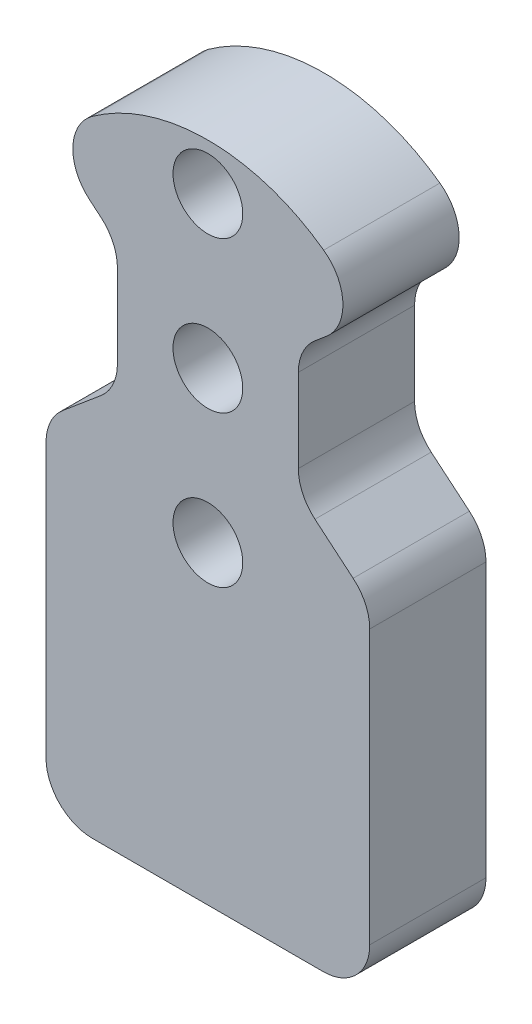
from build123d import *

# Parameters (mm, degrees)
SKETCH_1_R          = 8.5
EXTRUDE_1_DEPTH     = 5
SKETCH_2_R          = 1.5
CUT_EXTRUDE_1_DEPTH = 5
CUT_EXTRUDE_2_DEPTH = 14.019216566
EXTRUDE_2_DEPTH     = 5
SKETCH_6_R          = 1.5
CUT_EXTRUDE_3_DEPTH = 22.759606561
FILLET_2_R          = 2


with BuildPart() as part:
    # 草图1 → 凸台-拉伸1 (new body)
    with BuildSketch(Plane.XY):
        Circle(SKETCH_1_R)
    extrude(amount=EXTRUDE_1_DEPTH)

    # 草图2 → 切除-拉伸1 (cut)
    with BuildSketch(Plane.XY.offset(5)):
        with Locations((0, 6.5)):
            Circle(SKETCH_2_R)
        with Locations((0, -6.5)):
            Circle(SKETCH_2_R)
    extrude(amount=-CUT_EXTRUDE_1_DEPTH, mode=Mode.SUBTRACT)

    # 草图3 → 切除-拉伸2 (cut, through all)
    with BuildSketch(Plane(origin=(0, 0, 0), x_dir=(-1, 0, 0), z_dir=(0, 0, -1))):
        with BuildLine():
            ThreePointArc((3.89097221, 2.724488073), (4.530155516, 1.428352548), (4.75, 0))
            Line((4.75, 0), (8.5, 0))
            ThreePointArc((8.5, 0), (8.106594081, 2.555999296), (6.962792376, 4.875399709))
            Line((6.962792376, 4.875399709), (3.89097221, 2.724488073))
        make_face()
        with BuildLine():
            Line((8.5, 0), (4.75, 0))
            ThreePointArc((4.75, 0), (4.530155516, -1.428352548), (3.89097221, -2.724488073))
            Line((3.89097221, -2.724488073), (6.962792376, -4.875399709))
            ThreePointArc((6.962792376, -4.875399709), (8.106594081, -2.555999296), (8.5, 0))
        make_face()
    cut_extrude_2 = extrude(amount=-CUT_EXTRUDE_2_DEPTH, mode=Mode.SUBTRACT)

    # 镜向1: 切除-拉伸2 across plane
    add(cut_extrude_2.mirror(Plane(origin=(0, 0, 0), x_dir=(0, 0, 1), z_dir=(1, 0, 0))), mode=Mode.SUBTRACT)


with BuildPart() as body_2:
    # 草图4 → 凸台-拉伸2 (new body)
    with BuildSketch(Plane(origin=(0, 0, 0), x_dir=(-1, 0, 0), z_dir=(0, 0, -1))):
        with BuildLine():
            ThreePointArc((6.962792376, -4.875399709), (0, -8.5), (-6.962792376, -4.875399709))
            Line((-6.962792376, -4.875399709), (-6.962792376, -20))
            Line((-6.962792376, -20), (6.962792376, -20))
            Line((6.962792376, -20), (6.962792376, -4.875399709))
        make_face()
    extrude(amount=-EXTRUDE_2_DEPTH)


with BuildPart() as part_1:
    add(part.part)

    # Combine 1: union body 2
    add(body_2.part)

    # 草图6 → 切除-拉伸3 (cut, through all)
    with BuildSketch(Plane(origin=(0, 0, 0), x_dir=(-1, 0, 0), z_dir=(0, 0, -1))):
        with BuildLine():
            Line((-6.962792376, 4.875399709), (-3.89097221, 2.724488073))
            Line((-3.89097221, 2.724488073), (-6.769757712, 5.140075925))
            ThreePointArc((-6.769757712, 5.140075925), (-6.867550244, 5.008667851), (-6.962792376, 4.875399709))
        make_face()
        with BuildLine():
            Line((-3.89097221, -2.724488073), (-3.89097221, 2.724488073))
            ThreePointArc((-3.89097221, 2.724488073), (-4.75, 0), (-3.89097221, -2.724488073))
        make_face()
        Polygon((-6.962792376, -5.302051241), (-3.89097221, -2.724488073), (-6.962792376, -4.875399709), align=None)
        with BuildLine():
            ThreePointArc((6.962792376, 4.875399709), (6.867550244, 5.008667851), (6.769757712, 5.140075925))
            Line((6.769757712, 5.140075925), (3.89097221, 2.724488073))
            Line((3.89097221, 2.724488073), (6.962792376, 4.875399709))
        make_face()
        with BuildLine():
            ThreePointArc((3.89097221, -2.724488073), (4.75, 0), (3.89097221, 2.724488073))
            Line((3.89097221, 2.724488073), (3.89097221, -2.724488073))
        make_face()
        Polygon((6.962792376, -4.875399709), (3.89097221, -2.724488073), (6.962792376, -5.302051241), align=None)
        Circle(SKETCH_6_R)
    extrude(amount=-CUT_EXTRUDE_3_DEPTH, mode=Mode.SUBTRACT)

    # 圆角2
    fillet_2_edges = [part_1.edges().sort_by_distance(p)[0] for p in [
        (-6.769757712, 5.140075925, 2.5),
        (6.769757712, 5.140075925, 2.5),
        (-3.89097221, -2.724488073, 2.5),
        (-3.89097221, 2.724488073, 2.5),
        (3.89097221, 2.724488073, 2.5),
        (3.89097221, -2.724488073, 2.5),
        (-6.962792376, -20, 2.5),
        (6.962792376, -20, 2.5),
        (6.962792376, -5.302051241, 2.5),
        (-6.962792376, -5.302051241, 2.5),
    ]]
    fillet(fillet_2_edges, radius=FILLET_2_R)


solid = part_1.part
